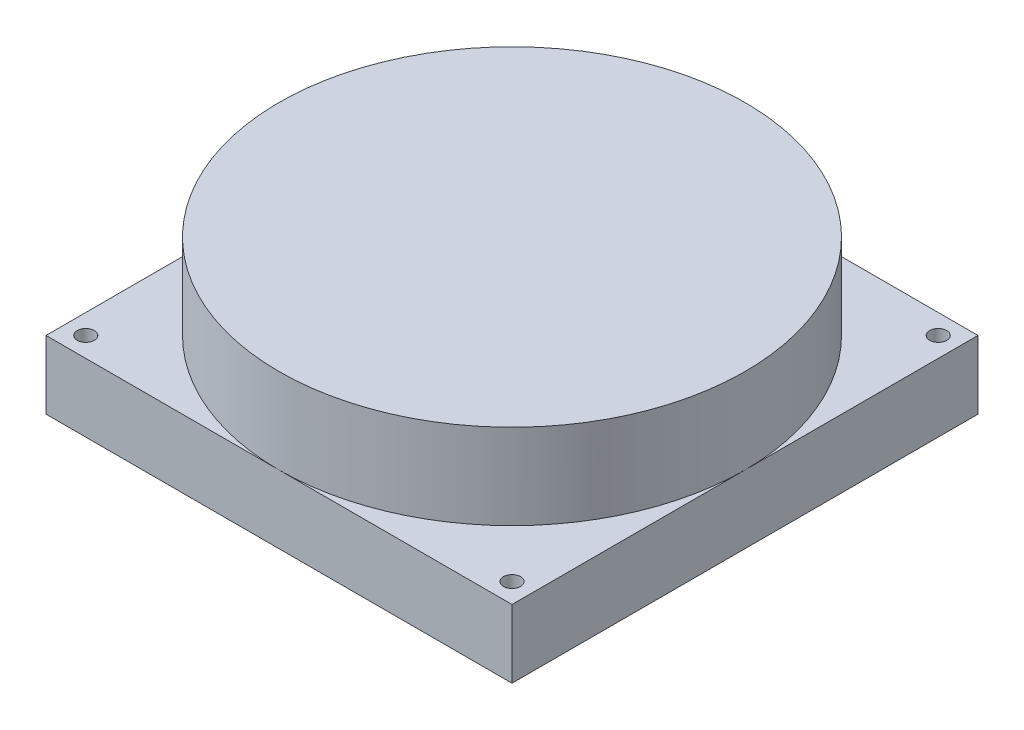
from build123d import *

# Parameters (mm, degrees)
SKETCH1_W           = 82
SKETCH1_H           = 82
BOSS_EXTRUDE1_DEPTH = 12
SKETCH2_R           = 1.5
CUT_EXTRUDE1_DEPTH  = 106.677700072
SKETCH3_R           = 41
BOSS_EXTRUDE2_DEPTH = 15
SKETCH4_R           = 1.5
CUT_EXTRUDE2_DEPTH  = 5


with BuildPart() as part:
    # Sketch1 → Boss-Extrude1 (new body)
    with BuildSketch(Plane(origin=(0, 0, 0), x_dir=(1, 0, 0), z_dir=(0, 1, 0))):
        with Locations((-48.046875, -14.627604167)):
            Rectangle(SKETCH1_W, SKETCH1_H)
    extrude(amount=BOSS_EXTRUDE1_DEPTH)

    # Sketch2 → Cut-Extrude1 (cut, through all)
    with BuildSketch(Plane.XZ):
        with Locations(Location((-85.546875, 52.127604167, 0), (0, 0, 270))):
            Circle(SKETCH2_R)
        with Locations(Location((-10.546875, 52.127604167, 0), (0, 0, 270))):
            Circle(SKETCH2_R)
        with Locations(Location((-85.546875, -22.872395833, 0), (0, 0, 270))):
            Circle(SKETCH2_R)
        with Locations(Location((-10.546875, -22.872395833, 0), (0, 0, 270))):
            Circle(SKETCH2_R)
    extrude(amount=-CUT_EXTRUDE1_DEPTH, mode=Mode.SUBTRACT)

    # Sketch3 → Boss-Extrude2 (add)
    with BuildSketch(Plane(origin=(0, 12, 0), x_dir=(1, 0, 0), z_dir=(0, 1, 0))):
        with Locations(Location((-48.046875, -14.627604167, 0), (0, 0, 270))):
            Circle(SKETCH3_R)
    extrude(amount=BOSS_EXTRUDE2_DEPTH)

    # Sketch4 → Cut-Extrude2 (cut)
    with BuildSketch(Plane.XZ):
        with Locations(Location((-57.046875, 14.877604167, 0), (0, 0, 270))):
            Circle(SKETCH4_R)
        with Locations(Location((-39.046875, 14.877604167, 0), (0, 0, 270))):
            Circle(SKETCH4_R)
    extrude(amount=-CUT_EXTRUDE2_DEPTH, mode=Mode.SUBTRACT)


solid = part.part
